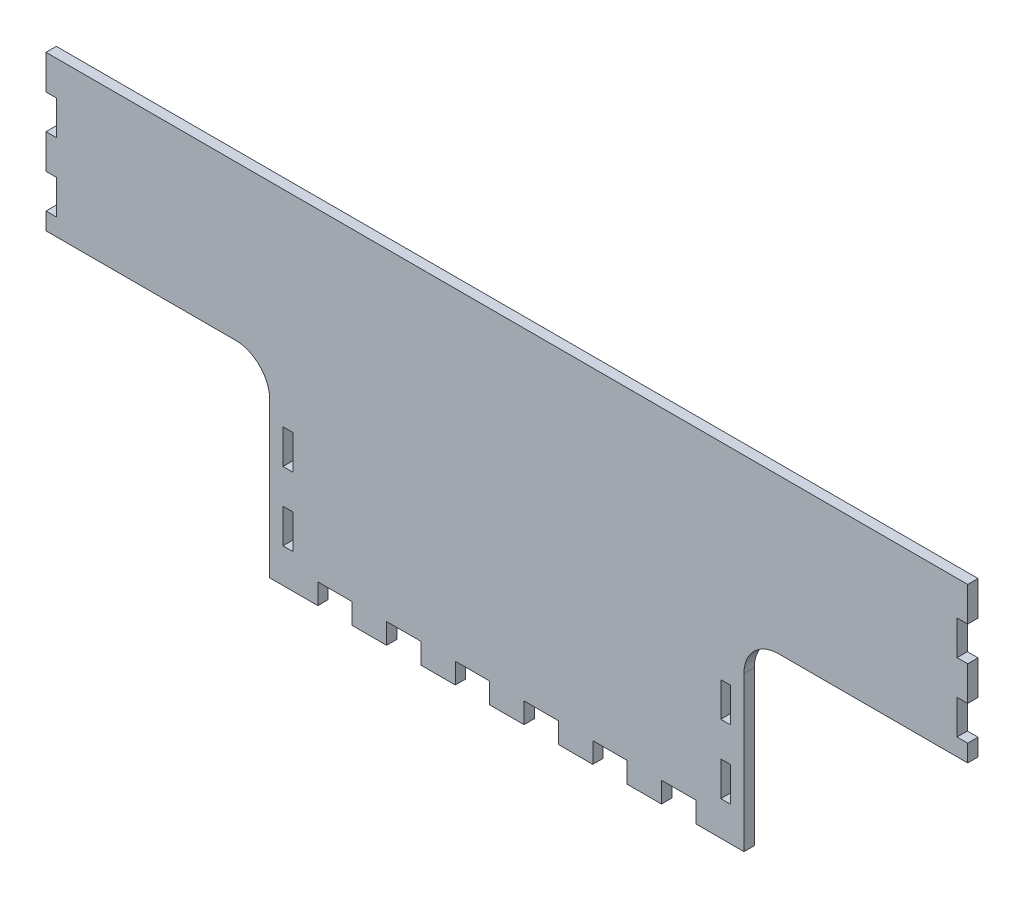
from build123d import *

# Parameters (mm, degrees)
BOSS_EXTRUDE1_DEPTH = 3
FILLET1_R           = 10
SKETCH2_W           = 2.9
SKETCH2_H           = 10
CUT_EXTRUDE1_DEPTH  = 168.247780254


with BuildPart() as part:
    # Sketch1 → Boss-Extrude1 (new body)
    with BuildSketch(Plane.XY):
        Polygon((-69, 54.9), (-69, 0), (-55, 0), (-55, 6), (-45, 6), (-45, 0), (-35, 0), (-35, 6), (-25, 6), (-25, 0), (-15, 0), (-15, 6), (-5, 6), (-5, 0), (5, 0), (5, 6), (15, 6), (15, 0), (25, 0), (25, 6), (35, 6), (35, 0), (45, 0), (45, 6), (55, 6), (55, 0), (69, 0), (69, 54.9), (134.1, 54.9), (134.1, 59.9), (131, 59.9), (131, 69.9), (134.1, 69.9), (134.1, 79.9), (131, 79.9), (131, 89.9), (134.1, 89.9), (134.1, 99.9), (-134.1, 99.9), (-134.1, 89.9), (-131, 89.9), (-131, 79.9), (-134.1, 79.9), (-134.1, 69.9), (-131, 69.9), (-131, 59.9), (-134.1, 59.9), (-134.1, 54.9), align=None)
    extrude(amount=BOSS_EXTRUDE1_DEPTH)

    # Fillet1
    fillet1_edges = [part.edges().sort_by_distance(p)[0] for p in [
        (69, 54.9, 1.5),
        (-69, 54.9, 1.5),
    ]]
    fillet(fillet1_edges, radius=FILLET1_R)

    # Sketch2 → Cut-Extrude1 (cut, through all)
    with BuildSketch(Plane(origin=(0, 0, 0), x_dir=(-1, 0, 0), z_dir=(0, 0, -1))):
        with Locations((-63.702453972, 15)):
            Rectangle(SKETCH2_W, SKETCH2_H)
        with Locations((-63.702453972, 35)):
            Rectangle(SKETCH2_W, SKETCH2_H)
        with Locations((63.702453972, 35)):
            Rectangle(SKETCH2_W, SKETCH2_H)
        with Locations((63.702453972, 15)):
            Rectangle(SKETCH2_W, SKETCH2_H)
    extrude(amount=-CUT_EXTRUDE1_DEPTH, mode=Mode.SUBTRACT)


solid = part.part
